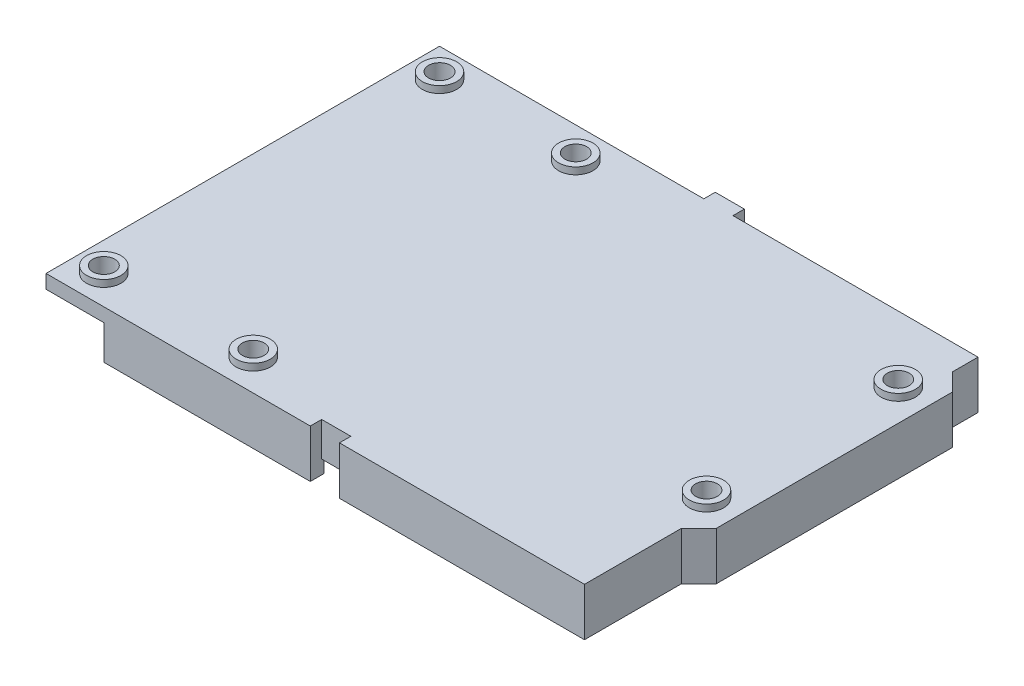
from build123d import *

# Parameters (mm, degrees)
SKETCH1_R            = 1.5875
BOSS_EXTRUDE1_DEPTH  = 2
BOSS_EXTRUDE2_START  = -2
BOSS_EXTRUDE2_DEPTH  = 5
BOSS_EXTRUDE3_START  = 1
SKETCH2_R            = 2.5
SKETCH2_R_2          = 1.5875
BOSS_EXTRUDE3_DEPTH  = 1
BOSS_EXTRUDE4_START  = -2
SKETCH1_4_W          = 4.25
SKETCH1_4_H          = 0.34
BOSS_EXTRUDE4_DEPTH  = 3
SKETCH3_R            = 1.5875
BOSS_EXTRUDE5_DEPTH  = 3
M3_CLEARANCE_HOLE1_D = 3.2


with BuildPart() as part:
    # Sketch1 → Boss-Extrude1 (new body)
    with BuildSketch(Plane(origin=(0, 0, 0), x_dir=(1, 0, 0), z_dir=(0, 1, 0))):
        Polygon((-10.42, 55.34), (-10.42, -2), (28.09, -2), (28.09, -0.34), (32.34, -0.34), (32.34, -2), (68.04, -2), (68.04, 12.125572875), (70.58, 14.665572875), (70.58, 49.088427125), (68.04, 51.628427125), (68.04, 55.34), (32.34, 55.34), (32.34, 57), (28.09, 57), (28.09, 55.34), align=None)
        with Locations(Location((15.24, 2.54, 0), (0, 0, 270))):
            Circle(SKETCH1_R, mode=Mode.SUBTRACT)
        with Locations(Location((66.04, 45.72, 0), (0, 0, 270))):
            Circle(SKETCH1_R, mode=Mode.SUBTRACT)
        with Locations(Location((13.97, 50.8, 0), (0, 0, 270))):
            Circle(SKETCH1_R, mode=Mode.SUBTRACT)
        with Locations(Location((66.04, 17.78, 0), (0, 0, 270))):
            Circle(SKETCH1_R, mode=Mode.SUBTRACT)
    extrude(amount=-BOSS_EXTRUDE1_DEPTH)

    # Sketch1<3> → Boss-Extrude2 (add)
    with BuildSketch(Plane(origin=(0, 0, 0), x_dir=(1, 0, 0), z_dir=(0, 1, 0)).offset(BOSS_EXTRUDE2_START)):
        Polygon((28.09, 55.34), (-2, 55.34), (-2, -2), (28.09, -2), (28.09, 0), (0, 0), (0, 53.34), (66.04, 53.34), (66.04, 50.8), (68.58, 48.26), (68.58, 15.494), (66.04, 12.954), (66.04, 0), (32.34, 0), (32.34, -2), (68.04, -2), (68.04, 12.125572875), (70.58, 14.665572875), (70.58, 49.088427125), (68.04, 51.628427125), (68.04, 55.34), (32.34, 55.34), (32.34, 57), (28.09, 57), align=None)
    extrude(amount=-BOSS_EXTRUDE2_DEPTH)

    # Sketch2 → Boss-Extrude3 (add)
    # profile 1 of 6: a face of its own
    with BuildSketch(Plane(origin=(0, 0, 0), x_dir=(1, 0, 0), z_dir=(0, 1, 0)).offset(BOSS_EXTRUDE3_START)):
        with Locations(Location((13.97, 50.8, 0), (0, 0, 270))):
            Circle(SKETCH2_R)
        with Locations(Location((13.97, 50.8, 0), (0, 0, 270))):
            Circle(SKETCH2_R_2, mode=Mode.SUBTRACT)
    # profile 2 of 6: a face of its own
    with BuildSketch(Plane(origin=(0, 0, 0), x_dir=(1, 0, 0), z_dir=(0, 1, 0)).offset(BOSS_EXTRUDE3_START)):
        with Locations(Location((66.04, 45.72, 0), (0, 0, 270))):
            Circle(SKETCH2_R)
        with Locations(Location((66.04, 45.72, 0), (0, 0, 270))):
            Circle(SKETCH2_R_2, mode=Mode.SUBTRACT)
    # profile 3 of 6: a face of its own
    with BuildSketch(Plane(origin=(0, 0, 0), x_dir=(1, 0, 0), z_dir=(0, 1, 0)).offset(BOSS_EXTRUDE3_START)):
        with Locations(Location((66.04, 17.78, 0), (0, 0, 270))):
            Circle(SKETCH2_R)
        with Locations(Location((66.04, 17.78, 0), (0, 0, 270))):
            Circle(SKETCH2_R_2, mode=Mode.SUBTRACT)
    # profile 4 of 6: a face of its own
    with BuildSketch(Plane(origin=(0, 0, 0), x_dir=(1, 0, 0), z_dir=(0, 1, 0)).offset(BOSS_EXTRUDE3_START)):
        with Locations(Location((15.24, 2.54, 0), (0, 0, 270))):
            Circle(SKETCH2_R)
        with Locations(Location((15.24, 2.54, 0), (0, 0, 270))):
            Circle(SKETCH2_R_2, mode=Mode.SUBTRACT)
    # profile 5 of 6: a face of its own
    with BuildSketch(Plane(origin=(0, 0, 0), x_dir=(1, 0, 0), z_dir=(0, 1, 0)).offset(BOSS_EXTRUDE3_START)):
        with Locations(Location((-6.21, 2.21, 0), (0, 0, 270))):
            Circle(SKETCH2_R)
    # profile 6 of 6: a face of its own
    with BuildSketch(Plane(origin=(0, 0, 0), x_dir=(1, 0, 0), z_dir=(0, 1, 0)).offset(BOSS_EXTRUDE3_START)):
        with Locations(Location((-6.21, 51.13, 0), (0, 0, 270))):
            Circle(SKETCH2_R)
    extrude(amount=-BOSS_EXTRUDE3_DEPTH)

    # Sketch1<4> → Boss-Extrude4 (add)
    with BuildSketch(Plane(origin=(0, 0, 0), x_dir=(1, 0, 0), z_dir=(0, 1, 0)).offset(BOSS_EXTRUDE4_START)):
        with Locations((30.215, -0.17)):
            Rectangle(SKETCH1_4_W, SKETCH1_4_H)
        Polygon((26.44, 0), (28.09, 0), (32.34, 0), (33.99, 0), (33.99, 1.31), (26.44, 1.31), align=None)
    extrude(amount=-BOSS_EXTRUDE4_DEPTH)

    # Sketch3 → Boss-Extrude5 (add)
    # profile 1 of 4: a face of its own
    with BuildSketch(Plane.XZ.offset(2)):
        with BuildLine():
            Line((12.74, 0), (12.74, -2.54))
            ThreePointArc((12.74, -2.54), (15.24, -5.04), (17.74, -2.54))
            Line((17.74, -2.54), (17.74, 0))
            Line((17.74, 0), (12.74, 0))
        make_face()
        with Locations(Location((15.24, -2.54, 0), (0, 0, 90))):
            Circle(SKETCH3_R, mode=Mode.SUBTRACT)
    # profile 2 of 4: a face of its own
    with BuildSketch(Plane.XZ.offset(2)):
        with BuildLine():
            Line((16.47, -53.34), (16.47, -50.8))
            ThreePointArc((16.47, -50.8), (13.97, -48.3), (11.47, -50.8))
            Line((11.47, -50.8), (11.47, -53.34))
            Line((11.47, -53.34), (16.47, -53.34))
        make_face()
        with Locations(Location((13.97, -50.8, 0), (0, 0, 90))):
            Circle(SKETCH3_R, mode=Mode.SUBTRACT)
    # profile 3 of 4: a face of its own
    with BuildSketch(Plane.XZ.offset(2)):
        with BuildLine():
            Line((68.58, -48.22), (66.04, -48.22))
            ThreePointArc((66.04, -48.22), (63.54, -45.72), (66.04, -43.22))
            Line((66.04, -43.22), (68.58, -43.22))
            Line((68.58, -43.22), (68.58, -48.22))
        make_face()
        with Locations(Location((66.04, -45.72, 0), (0, 0, 90))):
            Circle(SKETCH3_R, mode=Mode.SUBTRACT)
    # profile 4 of 4: a face of its own
    with BuildSketch(Plane.XZ.offset(2)):
        with BuildLine():
            Line((68.58, -20.28), (66.04, -20.28))
            ThreePointArc((66.04, -20.28), (63.54, -17.78), (66.04, -15.28))
            Line((66.04, -15.28), (68.58, -15.28))
            Line((68.58, -15.28), (68.58, -20.28))
        make_face()
        with Locations(Location((66.04, -17.78, 0), (0, 0, 90))):
            Circle(SKETCH3_R, mode=Mode.SUBTRACT)
    extrude(amount=BOSS_EXTRUDE5_DEPTH)

    # M3 Clearance Hole1 (through all)
    with Locations(Plane(origin=(0, 1, 0), x_dir=(1, 0, 0), z_dir=(0, 1, 0))):
        with Locations((-6.21, 51.13), (-6.21, 2.21)):
            Hole(M3_CLEARANCE_HOLE1_D / 2)


solid = part.part
